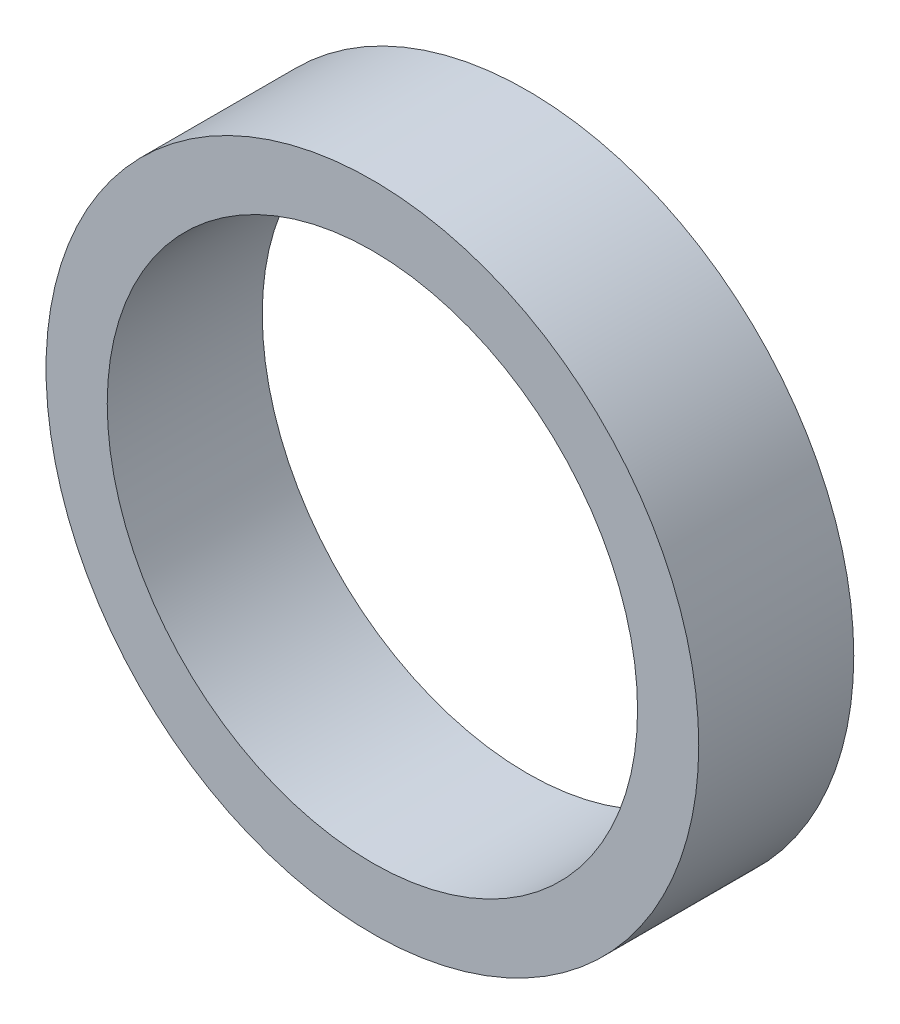
from build123d import *

# Parameters (mm, degrees)
SKETCH1_R           = 40
SKETCH1_R_2         = 32.5
BOSS_EXTRUDE1_DEPTH = 19


with BuildPart() as part:
    # Sketch1 → Boss-Extrude1 (new body)
    with BuildSketch(Plane.XY):
        Circle(SKETCH1_R)
        Circle(SKETCH1_R_2, mode=Mode.SUBTRACT)
    extrude(amount=BOSS_EXTRUDE1_DEPTH)


solid = part.part
